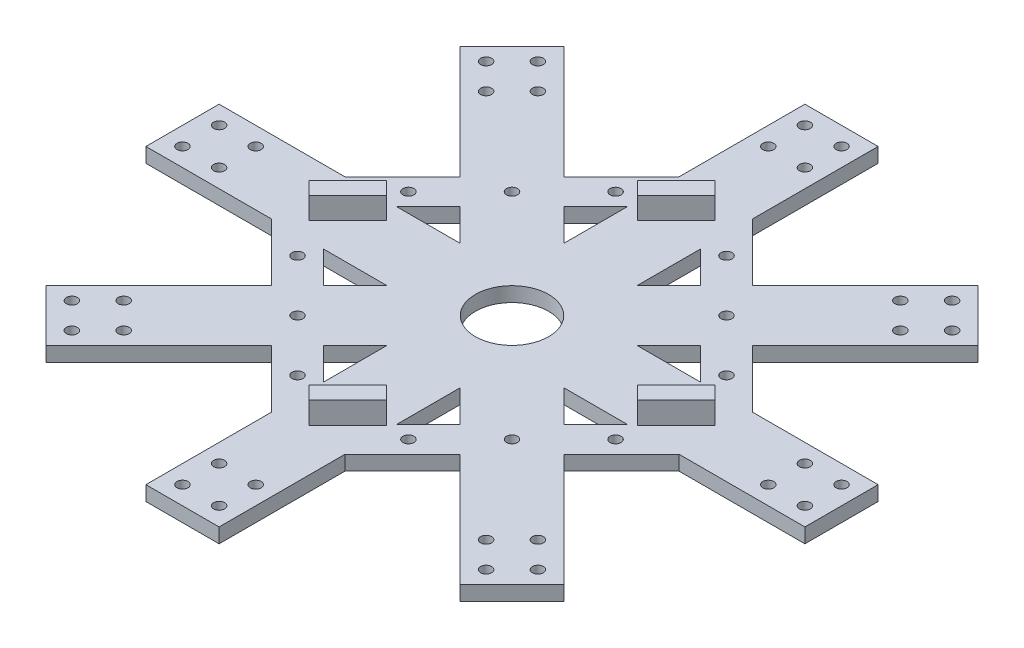
from build123d import *

# Parameters (mm, degrees)
SKETCH1_R             = 1.5
BASE_DEPTH            = 4
BATTERYCLIP_DEPTH     = 6
BOSS_EXTRUDE1_DEPTH   = 4
F_3_0MM_DOWEL_HOLE2_D = 3
CIRPATTERN2_COUNT     = 4
SKETCH7_R             = 10
REFRERENCE_DEPTH      = 10


with BuildPart() as part:
    # Sketch1 → Base (new body)
    with BuildSketch(Plane(origin=(0, 0, 0), x_dir=(1, 0, 0), z_dir=(0, 1, 0))):
        Polygon((100, 100), (65.656854249, 100), (20, 145.656854249), (20, 180), (0, 180), (0, 145.656854249), (-45.656854249, 100), (-80, 100), (-80, 80), (-45.656854249, 80), (0, 34.343145751), (0, 0), (20, 0), (20, 34.343145751), (65.656854249, 80), (100, 80), align=None)
        Polygon((51.514718626, 100), (20, 100), (20, 131.514718626), align=None, mode=Mode.SUBTRACT)
        Polygon((-31.514718626, 80), (0, 80), (0, 48.485281374), align=None, mode=Mode.SUBTRACT)
        Polygon((0, 131.514718626), (0, 100), (-31.514718626, 100), align=None, mode=Mode.SUBTRACT)
        Polygon((20, 48.485281374), (20, 80), (51.514718626, 80), align=None, mode=Mode.SUBTRACT)
        with Locations(Location((10, 90, 0), (0, 0, 270))):
            Circle(SKETCH1_R, mode=Mode.SUBTRACT)
    extrude(amount=BASE_DEPTH)

    # Sketch2 → BatteryClip (add)
    with BuildSketch(Plane(origin=(0, 4, 0), x_dir=(1, 0, 0), z_dir=(0, 1, 0))):
        Polygon((15.303300859, 50.402020254), (4.696699141, 39.795418536), (8.232233047, 36.25988463), (18.838834765, 46.866486348), align=None)
        Polygon((11.767766953, 143.74011537), (1.161165235, 133.133513652), (4.696699141, 129.597979746), (15.303300859, 140.204581464), align=None)
        Polygon((49.597979746, 84.696699141), (60.204581464, 95.303300859), (63.74011537, 91.767766953), (53.133513652, 81.161165235), align=None)
        Polygon((-43.74011537, 88.232233047), (-33.133513652, 98.838834765), (-29.597979746, 95.303300859), (-40.204581464, 84.696699141), align=None)
    extrude(amount=BATTERYCLIP_DEPTH)

    # Sketch6 → Boss-Extrude1 (add)
    with BuildSketch(Plane.XZ):
        Polygon((66.568542495, -160.710678119), (10, -104.142135624), (-46.568542495, -160.710678119), (-60.710678119, -146.568542495), (-4.142135624, -90), (-60.710678119, -33.431457505), (-46.568542495, -19.289321881), (10, -75.857864376), (66.568542495, -19.289321881), (80.710678119, -33.431457505), (24.142135624, -90), (80.710678119, -146.568542495), align=None)
    extrude(amount=-BOSS_EXTRUDE1_DEPTH)

    # Ø3.0mm Dowel Hole2 (through all)
    with Locations(Plane(origin=(5, 4, -5), x_dir=(0, 0, 1), z_dir=(0, 1, 0))):
        with Locations((0, 0), (-10, 0), (-10, 10), (0, 10), (-41.564971157, -10.150757595), (-55.707106781, -24.292893219), (-69.849242405, -38.435028843), (-28.431457505, -58.639610307), (-35.502525317, -51.568542495), (-28.431457505, -44.497474683), (-21.360389693, -51.568542495)):
            f_3_0mm_dowel_hole2 = Hole(F_3_0MM_DOWEL_HOLE2_D / 2)

    # CirPattern2: Ø3.0mm Dowel Hole2 ×4 about axis
    cirpattern2_axis = Axis((10, 0, -90), (0, 1, 0))
    for i in range(1, CIRPATTERN2_COUNT):
        add(f_3_0mm_dowel_hole2.rotate(cirpattern2_axis, i * 360 / CIRPATTERN2_COUNT), mode=Mode.SUBTRACT)

    # Sketch7 → Refrerence (cut)
    with BuildSketch(Plane(origin=(0, 4, 0), x_dir=(1, 0, 0), z_dir=(0, 1, 0))):
        with Locations(Location((10, 90, 0), (0, 0, 270))):
            Circle(SKETCH7_R)
    extrude(amount=-REFRERENCE_DEPTH, mode=Mode.SUBTRACT)


solid = part.part
